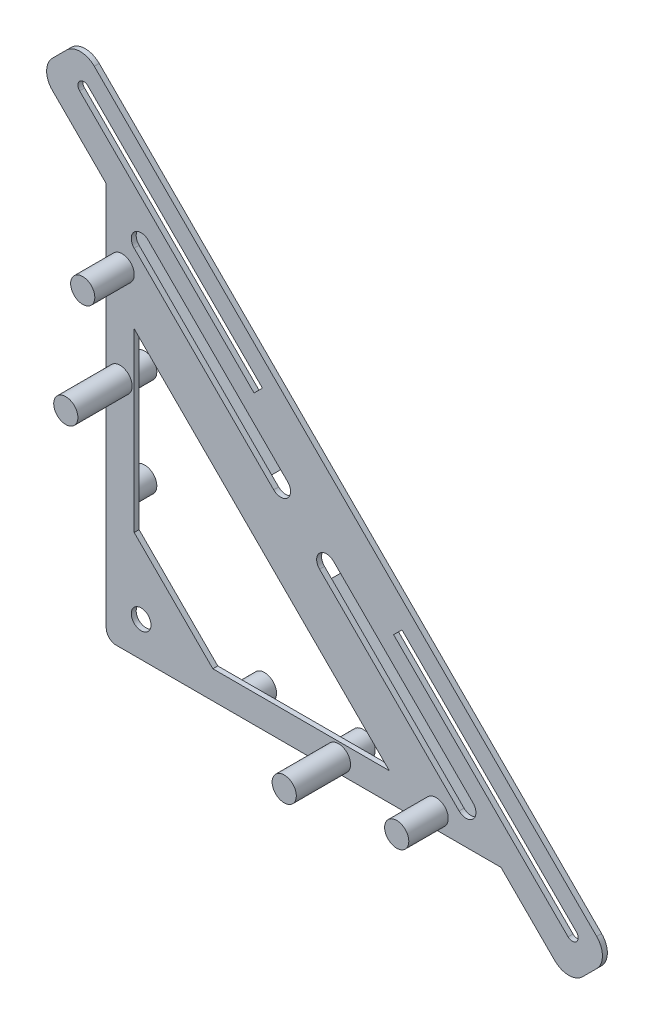
from build123d import *

# Parameters (mm, degrees)
SKETCH1_R           = 100
BOSS_EXTRUDE1_DEPTH = 50
SKETCH3_R           = 122.5
BOSS_EXTRUDE3_DEPTH = 200
BOSS_EXTRUDE4_START = -600
SKETCH3_2_R         = 122.5
BOSS_EXTRUDE4_DEPTH = 600
SKETCH6_R           = 122.5
BOSS_EXTRUDE5_DEPTH = 400
CUT_EXTRUDE1_DEPTH  = 4435.241761564
FILLET1_R           = 200


with BuildPart() as part:
    # Sketch1 → Boss-Extrude1 (new body)
    with BuildSketch(Plane.XY):
        with BuildLine():
            Line((-2000, 2000), (-2000, -1900))
            ThreePointArc((-2000, -1900), (-1970.710678119, -1970.710678119), (-1900, -2000))
            Line((-1900, -2000), (2000, -2000))
            Line((2000, -2000), (2687.005768509, -2687.005768509))
            Line((2687.005768509, -2687.005768509), (3111.269837221, -2262.741699797))
            Line((3111.269837221, -2262.741699797), (2000, -1151.471862576))
            Line((2000, -1151.471862576), (1717.157287525, -868.629150102))
            Line((1717.157287525, -868.629150102), (-868.629150102, 1717.157287525))
            Line((-868.629150102, 1717.157287525), (-1151.471862576, 2000))
            Line((-1151.471862576, 2000), (-2262.741699797, 3111.269837221))
            Line((-2262.741699797, 3111.269837221), (-2687.005768509, 2687.005768509))
            Line((-2687.005768509, 2687.005768509), (-2000, 2000))
        make_face()
        with Locations((-1646.446609407, -1646.446609407)):
            Circle(SKETCH1_R, mode=Mode.SUBTRACT)
        with BuildLine():
            Line((1575.735931288, -1717.157287525), (161.522368915, -302.943725152))
            ThreePointArc((161.522368915, -302.943725152), (161.522368915, -161.522368915), (302.943725152, -161.522368915))
            Line((302.943725152, -161.522368915), (1717.157287525, -1575.735931288))
            ThreePointArc((1717.157287525, -1575.735931288), (1717.157287525, -1717.157287525), (1575.735931288, -1717.157287525))
        make_face(mode=Mode.SUBTRACT)
        with BuildLine():
            Line((-302.943725152, 161.522368915), (-1717.157287525, 1575.735931288))
            ThreePointArc((-1717.157287525, 1575.735931288), (-1717.157287525, 1717.157287525), (-1575.735931288, 1717.157287525))
            Line((-1575.735931288, 1717.157287525), (-161.522368915, 302.943725152))
            ThreePointArc((-161.522368915, 302.943725152), (-161.522368915, 161.522368915), (-302.943725152, 161.522368915))
        make_face(mode=Mode.SUBTRACT)
        Polygon((-919.659730978, -1717.157287525), (868.629150102, -1717.157287525), (-1717.157287525, 868.629150102), (-1717.157287525, -919.659730978), align=None, mode=Mode.SUBTRACT)
    extrude(amount=BOSS_EXTRUDE1_DEPTH)

    # Sketch3 → Boss-Extrude3 (add)
    with BuildSketch(Plane(origin=(0, 0, 0), x_dir=(-1, 0, 0), z_dir=(0, 0, -1))):
        with Locations((646.446609407, -1860)):
            Circle(SKETCH3_R)
        with Locations((-353.553390593, -1860)):
            Circle(SKETCH3_R)
        with Locations((1860, -646.446609407)):
            Circle(SKETCH3_R)
        with Locations((1860, 353.553390593)):
            Circle(SKETCH3_R)
        Polygon((1858.578643763, 1575.735931288), (444.36508139, 161.522368915), (479.720420449, 126.167029856), (1893.933982822, 1540.380592229), align=None)
        Polygon((-1540.380592229, -1893.933982822), (-1575.735931288, -1858.578643763), (-161.522368915, -444.36508139), (-126.167029856, -479.720420449), align=None)
    extrude(amount=BOSS_EXTRUDE3_DEPTH)

    # Sketch3<2> → Boss-Extrude4 (add)
    with BuildSketch(Plane(origin=(0, 0, 0), x_dir=(-1, 0, 0), z_dir=(0, 0, -1)).offset(BOSS_EXTRUDE4_START)):
        with Locations((-353.553390593, -1860)):
            Circle(SKETCH3_2_R)
        with Locations((1860, 353.553390593)):
            Circle(SKETCH3_2_R)
    extrude(amount=BOSS_EXTRUDE4_DEPTH)

    # Sketch6 → Boss-Extrude5 (add)
    with BuildSketch(Plane.XY.offset(50)):
        with Locations((-1838.477631085, 1343.502884254)):
            Circle(SKETCH6_R)
        with Locations((1343.502884254, -1838.477631085)):
            Circle(SKETCH6_R)
    extrude(amount=BOSS_EXTRUDE5_DEPTH)

    # Sketch8 → Cut-Extrude1 (cut, through all)
    with BuildSketch(Plane.XY.offset(50)):
        with BuildLine():
            Line((-2269.860497369, 2679.886970937), (-502.093544403, 912.12001797))
            Line((-502.093544403, 912.12001797), (-417.14527114, 997.068291233))
            Line((-417.14527114, 997.068291233), (-2184.912224106, 2764.8352442))
            ThreePointArc((-2184.912224106, 2764.8352442), (-2269.860497369, 2764.8352442), (-2269.860497369, 2679.886970937))
        make_face()
        with BuildLine():
            Line((912.12001797, -502.093544403), (997.068291233, -417.14527114))
            Line((997.068291233, -417.14527114), (2764.8352442, -2184.912224106))
            ThreePointArc((2764.8352442, -2184.912224106), (2764.8352442, -2269.860497369), (2679.886970937, -2269.860497369))
            Line((2679.886970937, -2269.860497369), (912.12001797, -502.093544403))
        make_face()
    extrude(amount=-CUT_EXTRUDE1_DEPTH, mode=Mode.SUBTRACT)

    # Fillet1
    fillet1_edges = [part.edges().sort_by_distance(p)[0] for p in [
        (-2687.005768509, 2687.005768509, 25),
        (-2262.741699797, 3111.269837221, 25),
        (3111.269837221, -2262.741699797, 25),
        (2687.005768509, -2687.005768509, 25),
    ]]
    fillet(fillet1_edges, radius=FILLET1_R)


solid = part.part
